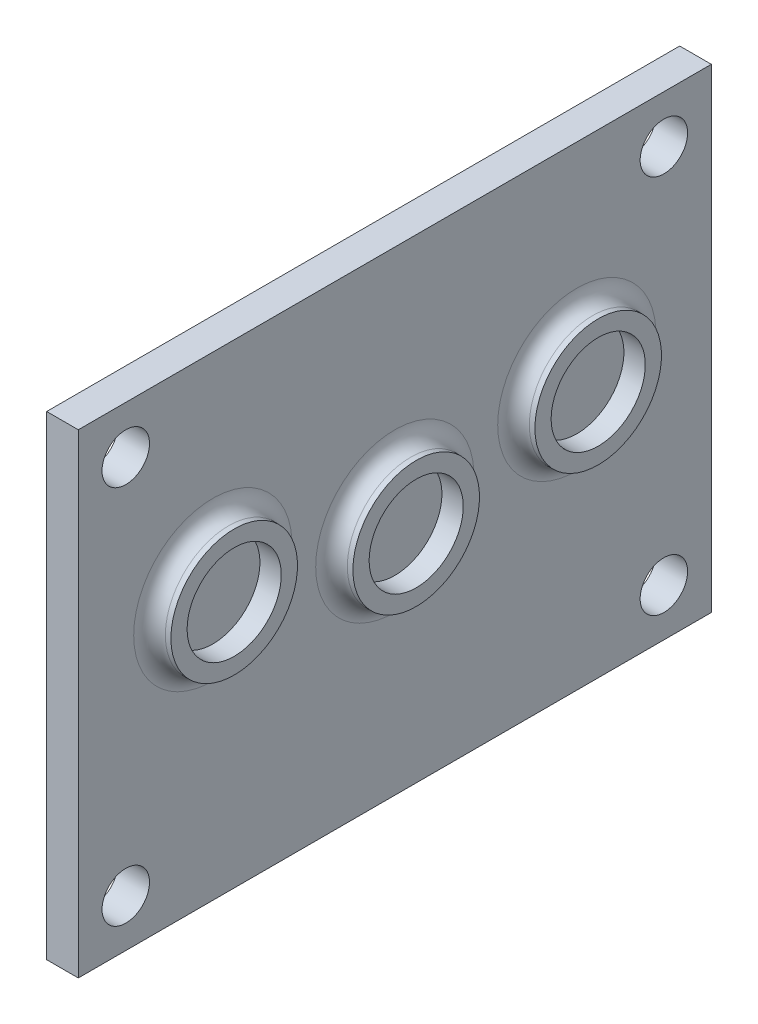
from build123d import *

# Parameters (mm, degrees)
SKETCH2_W           = 40
SKETCH2_H           = 30
BOSS_EXTRUDE1_DEPTH = 2
SKETCH3_R           = 4
SKETCH3_R_2         = 2.975
BOSS_EXTRUDE2_DEPTH = 1.35
FILLET1_R           = 1
SKETCH4_R           = 1.5
CUT_EXTRUDE1_DEPTH  = 2


with BuildPart() as part:
    # Sketch2 → Boss-Extrude1 (new body)
    with BuildSketch(Plane(origin=(0, 0, 0), x_dir=(0, 0, -1), z_dir=(1, 0, 0))):
        with Locations((20, 15)):
            Rectangle(SKETCH2_W, SKETCH2_H)
    extrude(amount=BOSS_EXTRUDE1_DEPTH)

    # Sketch3 → Boss-Extrude2 (add)
    # profile 1 of 3: a face of its own
    with BuildSketch(Plane(origin=(2, 0, 0), x_dir=(0, 0, -1), z_dir=(1, 0, 0))):
        with Locations(Location((8.5, 17, 0), (0, 0, 180))):
            Circle(SKETCH3_R)
        with Locations(Location((8.5, 17, 0), (0, 0, 180))):
            Circle(SKETCH3_R_2, mode=Mode.SUBTRACT)
    # profile 2 of 3: a face of its own
    with BuildSketch(Plane(origin=(2, 0, 0), x_dir=(0, 0, -1), z_dir=(1, 0, 0))):
        with Locations(Location((20, 15, 0), (0, 0, 180))):
            Circle(SKETCH3_R)
        with Locations(Location((20, 15, 0), (0, 0, 180))):
            Circle(SKETCH3_R_2, mode=Mode.SUBTRACT)
    # profile 3 of 3: a face of its own
    with BuildSketch(Plane(origin=(2, 0, 0), x_dir=(0, 0, -1), z_dir=(1, 0, 0))):
        with Locations(Location((31.5, 17, 0), (0, 0, 180))):
            Circle(SKETCH3_R)
        with Locations(Location((31.5, 17, 0), (0, 0, 180))):
            Circle(SKETCH3_R_2, mode=Mode.SUBTRACT)
    extrude(amount=BOSS_EXTRUDE2_DEPTH)

    # Fillet1
    fillet1_edges = [part.edges().sort_by_distance(p)[0] for p in [
        (2, 17, -12.5),
        (2, 15, -24),
        (2, 17, -35.5),
    ]]
    fillet(fillet1_edges, radius=FILLET1_R)

    # Sketch4 → Cut-Extrude1 (cut)
    with BuildSketch(Plane.ZY):
        with Locations((-37, 27)):
            Circle(SKETCH4_R)
        with Locations((-3, 27)):
            Circle(SKETCH4_R)
        with Locations((-37, 3)):
            Circle(SKETCH4_R)
        with Locations((-3, 3)):
            Circle(SKETCH4_R)
    extrude(amount=-CUT_EXTRUDE1_DEPTH, mode=Mode.SUBTRACT)


solid = part.part
